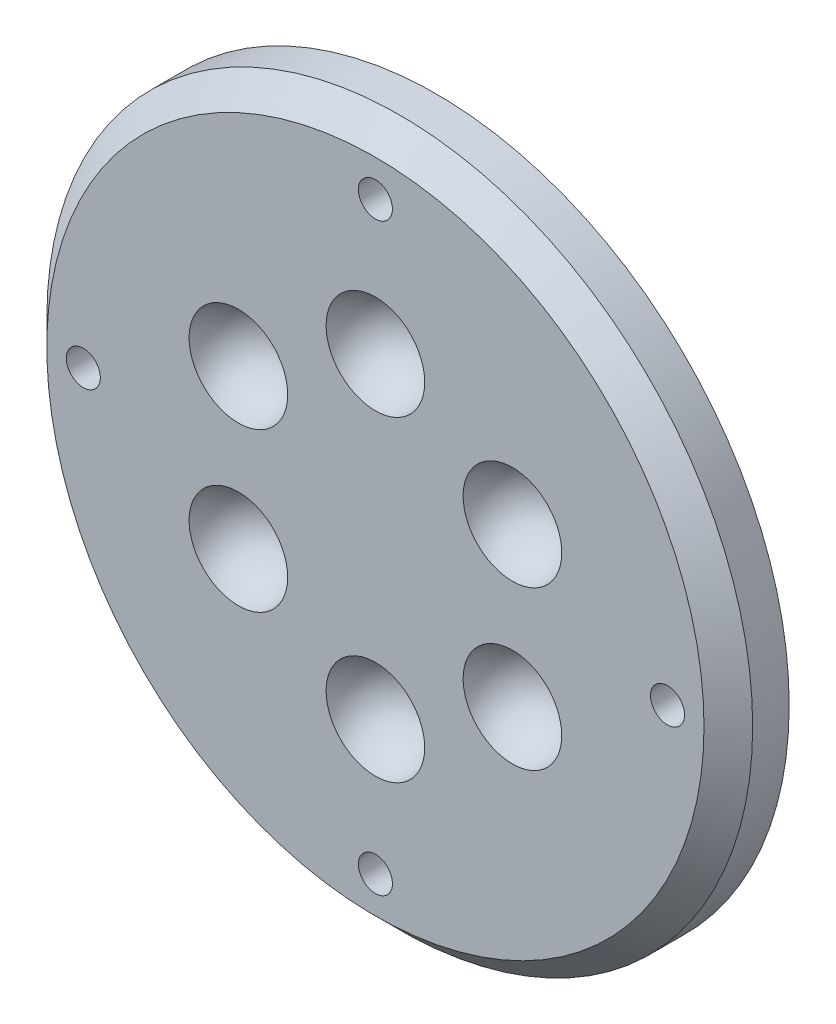
from build123d import *

# Parameters (mm, degrees)
SKETCH1_R             = 18.415
BOSS_EXTRUDE1_DEPTH   = 3.175
CIRPATTERN1_COUNT     = 6
F_2_56_TAPPED_HOLE1_D = 1.778
CHAMFER1_SIZE         = 1.27


with BuildPart() as part:
    # Sketch1 → Boss-Extrude1 (new body)
    with BuildSketch(Plane.XY):
        Circle(SKETCH1_R)
    extrude(amount=BOSS_EXTRUDE1_DEPTH)

    # Sketch3 → Cut-Revolve1 (revolve, cut)
    with BuildSketch(Plane(origin=(0, 0, 0), x_dir=(0, 0, -1), z_dir=(1, 0, 0))):
        with BuildLine():
            Line((-6.01345, 8.255), (-0.84455, 8.255))
            ThreePointArc((-0.84455, 8.255), (-3.429, 10.83945), (-6.01345, 8.255))
        make_face()
    cut_revolve1 = revolve(axis=Axis((0, 8.255, 6.01345), (0, 0, -1)), mode=Mode.SUBTRACT)

    # CirPattern1: Cut-Revolve1 ×6 about axis
    cirpattern1_axis = Axis((0, 0, 3.175), (0, 0, -1))
    for i in range(1, CIRPATTERN1_COUNT):
        add(cut_revolve1.rotate(cirpattern1_axis, i * 360 / CIRPATTERN1_COUNT), mode=Mode.SUBTRACT)

    # #2-56 Tapped Hole1 (through all)
    with Locations(Plane(origin=(0, 0, 0), x_dir=(-1, 0, 0), z_dir=(0, 0, -1))):
        with Locations((0, 15.24), (15.24, 0), (0, -15.24), (-15.24, 0)):
            Hole(F_2_56_TAPPED_HOLE1_D / 2)

    # Chamfer1
    chamfer1_edges = [part.edges().sort_by_distance(p)[0] for p in [
        (-18.415, 0, 3.175),
    ]]
    chamfer(chamfer1_edges, length=CHAMFER1_SIZE)


solid = part.part
